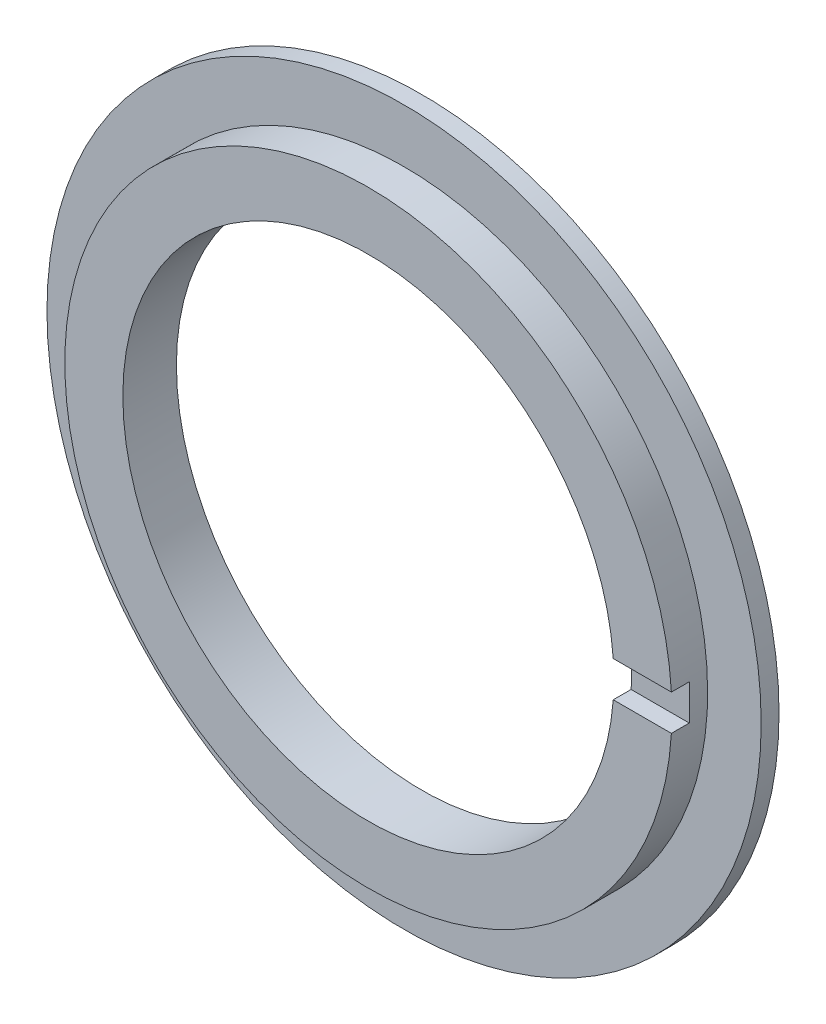
from build123d import *

# Parameters (mm, degrees)
SKETCH_1_R          = 40
EXTRUDE_1_DEPTH     = 2
SKETCH_2_R          = 34
EXTRUDE_2_DEPTH     = 6
SKETCH_3_R          = 27.5
CUT_EXTRUDE_1_DEPTH = 57.885850613
SKETCH_4_W          = 46.937334883
SKETCH_4_H          = 4
CUT_EXTRUDE_2_DEPTH = 2


with BuildPart() as part:
    # 草图1 → 凸台-拉伸1 (new body)
    with BuildSketch(Plane.XY):
        Circle(SKETCH_1_R)
    extrude(amount=EXTRUDE_1_DEPTH)

    # 草图2 → 凸台-拉伸2 (add)
    with BuildSketch(Plane.XY):
        Circle(SKETCH_2_R)
    extrude(amount=EXTRUDE_2_DEPTH)

    # 草图3 → 切除-拉伸1 (cut, through all)
    with BuildSketch(Plane.XY.offset(6)):
        Circle(SKETCH_3_R)
    extrude(amount=-CUT_EXTRUDE_1_DEPTH, mode=Mode.SUBTRACT)

    # 草图4 → 切除-拉伸2 (cut)
    with BuildSketch(Plane.XY.offset(6)):
        with Locations((30.403538279, 0)):
            Rectangle(SKETCH_4_W, SKETCH_4_H)
    extrude(amount=-CUT_EXTRUDE_2_DEPTH, mode=Mode.SUBTRACT)


solid = part.part
